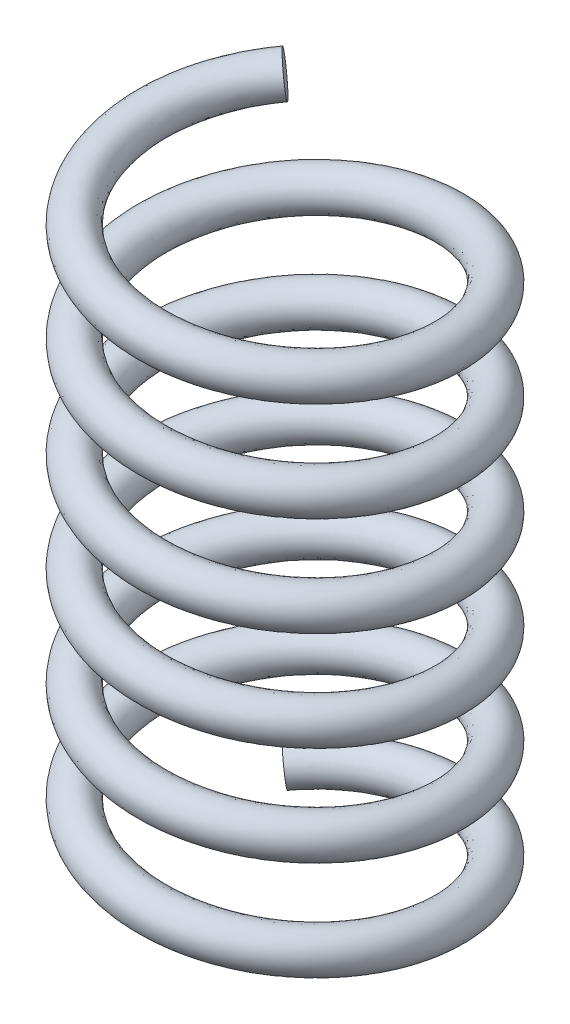
from build123d import *

# Parameters (mm, degrees)
SWEEP_1_PITCH       = 5
SWEEP_1_HEIGHT      = 30
SWEEP_1_RADIUS      = 7.5
SWEEP_1_START_ANGLE = -135
SKETCH_2_R          = 1


with BuildPart() as part:
    # 扫描1: sweep along a helix
    with BuildLine() as sweep_1_path:
        add(Helix(SWEEP_1_PITCH, SWEEP_1_HEIGHT, SWEEP_1_RADIUS, center=(0, 0, 0), direction=(0, 1, 0), lefthand=True, mode=Mode.PRIVATE).rotate(Axis((0, 0, 0), (0, 1, 0)), SWEEP_1_START_ANGLE))
    # 草图2 → 扫描1 (sweep)
    with BuildSketch(Plane(origin=(-5.303300859, 0, -5.303300859), x_dir=(-0.698320384233244, 0.2886362755737767, -0.6550097261775838), z_dir=(0.703159804126733, 0.10551104075352286, -0.7031598041267455))):
        Circle(SKETCH_2_R)
    sweep(path=sweep_1_path.line, is_frenet=True)


solid = part.part
